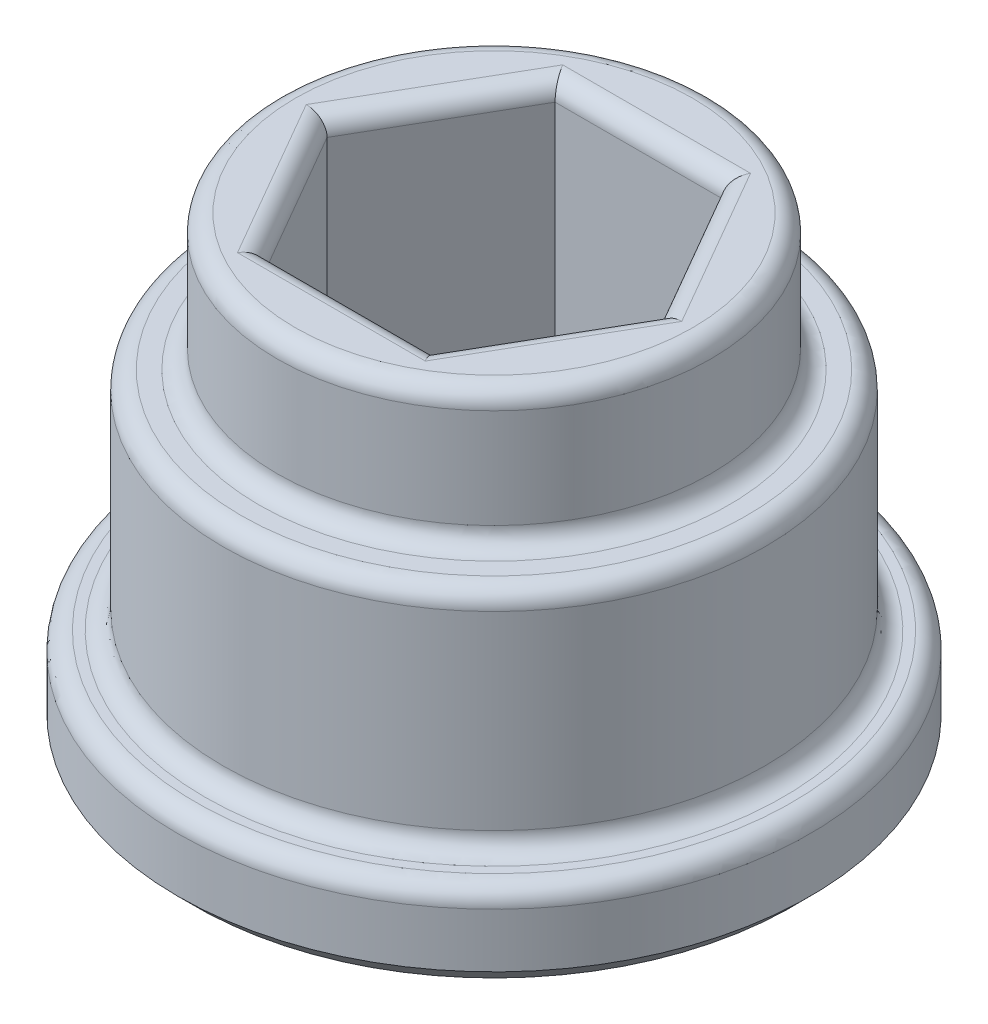
from build123d import *

# Parameters (mm, degrees)
SKETCH1_R           = 9.525
BOSS_EXTRUDE1_DEPTH = 7.9375
SKETCH2_R           = 7.62
BOSS_EXTRUDE2_DEPTH = 4.7625
SKETCH3_R           = 11.1125
BOSS_EXTRUDE3_DEPTH = 3.175
FILLET1_R           = 0.635
FILLET3_R           = 0.635
FILLET4_R           = 0.635
CHAMFER1_SIZE       = 0.635


with BuildPart() as part:
    # Sketch1 → Boss-Extrude1 (new body)
    with BuildSketch(Plane(origin=(0, 0, 0), x_dir=(1, 0, 0), z_dir=(0, 1, 0))):
        with Locations(Location((0, 0, 0), (0, 0, 270))):
            Circle(SKETCH1_R)
        Polygon((5.865878735, 0), (2.932939367, 5.08), (-2.932939367, 5.08), (-5.865878735, 0), (-2.932939367, -5.08), (2.932939367, -5.08), align=None, mode=Mode.SUBTRACT)
    extrude(amount=BOSS_EXTRUDE1_DEPTH)

    # Sketch2 → Boss-Extrude2 (add)
    with BuildSketch(Plane(origin=(0, 7.9375, 0), x_dir=(1, 0, 0), z_dir=(0, 1, 0))):
        with Locations(Location((0, 0, 0), (0, 0, 90))):
            Circle(SKETCH2_R)
        Polygon((-2.932939367, 5.08), (-5.865878735, 0), (-2.932939367, -5.08), (2.932939367, -5.08), (5.865878735, 0), (2.932939367, 5.08), align=None, mode=Mode.SUBTRACT)
    extrude(amount=BOSS_EXTRUDE2_DEPTH)

    # Sketch3 → Boss-Extrude3 (add)
    with BuildSketch(Plane.XZ):
        with Locations(Location((0, 0, 0), (0, 0, 270))):
            Circle(SKETCH3_R)
        Polygon((-2.932939367, 5.08), (2.932939367, 5.08), (5.865878735, 0), (2.932939367, -5.08), (-2.932939367, -5.08), (-5.865878735, 0), align=None, mode=Mode.SUBTRACT)
    extrude(amount=BOSS_EXTRUDE3_DEPTH)

    # Fillet1
    fillet1_edges = [part.edges().sort_by_distance(p)[0] for p in [
        (0, 0, -9.525),
        (0, 0, 11.1125),
    ]]
    fillet(fillet1_edges, radius=FILLET1_R)

    # Fillet3
    fillet3_edges = [part.edges().sort_by_distance(p)[0] for p in [
        (0, 12.7, -5.08),
        (-4.399409051, 12.7, -2.54),
        (-4.399409051, 12.7, 2.54),
        (0, 12.7, 5.08),
        (4.399409051, 12.7, 2.54),
        (4.399409051, 12.7, -2.54),
    ]]
    fillet(fillet3_edges, radius=FILLET3_R)

    # Fillet4
    fillet4_edges = [part.edges().sort_by_distance(p)[0] for p in [
        (0, 12.7, 7.62),
        (0, 7.9375, 7.62),
        (0, 7.9375, -9.525),
    ]]
    fillet(fillet4_edges, radius=FILLET4_R)

    # Chamfer1
    chamfer1_edges = [part.edges().sort_by_distance(p)[0] for p in [
        (0, -3.175, 11.1125),
        (-4.399409051, -3.175, 2.54),
        (-4.399409051, -3.175, -2.54),
        (0, -3.175, -5.08),
        (4.399409051, -3.175, -2.54),
        (4.399409051, -3.175, 2.54),
        (0, -3.175, 5.08),
    ]]
    chamfer(chamfer1_edges, length=CHAMFER1_SIZE)


solid = part.part
